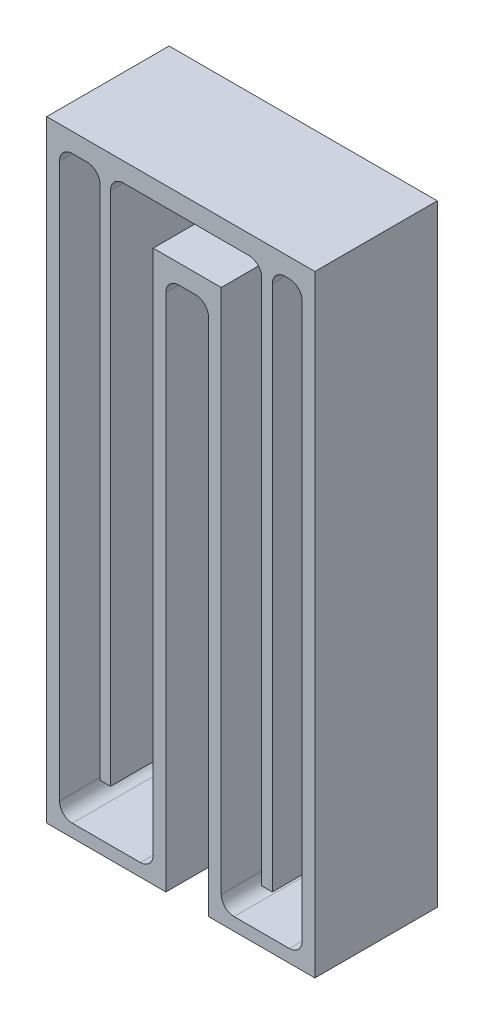
from build123d import *

# Parameters (mm, degrees)
BOSS_EXTRUDE1_DEPTH = 20
BOSS_EXTRUDE2_START = -3
BOSS_EXTRUDE2_DEPTH = 3


with BuildPart() as part:
    # Sketch1 → Boss-Extrude1 (new body)
    with BuildSketch(Plane.XY):
        with BuildLine():
            Line((0, 0), (0, 97.6))
            ThreePointArc((0, 97.6), (0.702943725, 99.297056275), (2.4, 100))
            Line((2.4, 100), (5.6, 100))
            ThreePointArc((5.6, 100), (7.297056275, 99.297056275), (8, 97.6))
            Line((8, 97.6), (8, 0))
            Line((8, 0), (28, 0))
            Line((28, 0), (28, 115))
            Line((28, 115), (18, 115))
            Line((18, 115), (-10, 115))
            Line((-10, 115), (-22.4, 115))
            Line((-22.4, 115), (-22.4, 0))
            Line((-22.4, 0), (0, 0))
        make_face()
        with BuildLine():
            Line((18, 109), (18, 10))
            Line((18, 10), (20, 10))
            Line((20, 10), (20, 109))
            ThreePointArc((20, 109), (20.702943725, 110.697056275), (22.4, 111.4))
            Line((22.4, 111.4), (23.2, 111.4))
            ThreePointArc((23.2, 111.4), (24.897056275, 110.697056275), (25.6, 109))
            Line((25.6, 109), (25.6, 4.8))
            ThreePointArc((25.6, 4.8), (24.897056275, 3.102943725), (23.2, 2.4))
            Line((23.2, 2.4), (12.8, 2.4))
            ThreePointArc((12.8, 2.4), (11.102943725, 3.102943725), (10.4, 4.8))
            Line((10.4, 4.8), (10.4, 103.6))
            Line((10.4, 103.6), (-2.4, 103.6))
            Line((-2.4, 103.6), (-2.4, 4.8))
            ThreePointArc((-2.4, 4.8), (-3.102943725, 3.102943725), (-4.8, 2.4))
            Line((-4.8, 2.4), (-17.6, 2.4))
            ThreePointArc((-17.6, 2.4), (-19.297056275, 3.102943725), (-20, 4.8))
            Line((-20, 4.8), (-20, 109))
            ThreePointArc((-20, 109), (-19.297056275, 110.697056275), (-17.6, 111.4))
            Line((-17.6, 111.4), (-14.8, 111.4))
            ThreePointArc((-14.8, 111.4), (-13.102943725, 110.697056275), (-12.4, 109))
            Line((-12.4, 109), (-12.4, 12))
            Line((-12.4, 12), (-10.4, 12))
            Line((-10.4, 12), (-10.4, 109))
            ThreePointArc((-10.4, 109), (-9.697056275, 110.697056275), (-8, 111.4))
            Line((-8, 111.4), (15.6, 111.4))
            ThreePointArc((15.6, 111.4), (17.297056275, 110.697056275), (18, 109))
        make_face(mode=Mode.SUBTRACT)
    extrude(amount=BOSS_EXTRUDE1_DEPTH)

    # Sketch2 → Boss-Extrude2 (add)
    with BuildSketch(Plane.XY.offset(BOSS_EXTRUDE2_START)):
        with BuildLine():
            Line((28, 115), (-22.4, 115))
            Line((-22.4, 115), (-22.4, 0))
            Line((-22.4, 0), (0, 0))
            Line((0, 0), (0, 97.6))
            ThreePointArc((0, 97.6), (0.702943725, 99.297056275), (2.4, 100))
            Line((2.4, 100), (5.6, 100))
            ThreePointArc((5.6, 100), (7.297056275, 99.297056275), (8, 97.6))
            Line((8, 97.6), (8, 0))
            Line((8, 0), (28, 0))
            Line((28, 0), (28, 115))
        make_face()
    extrude(amount=BOSS_EXTRUDE2_DEPTH)


solid = part.part
